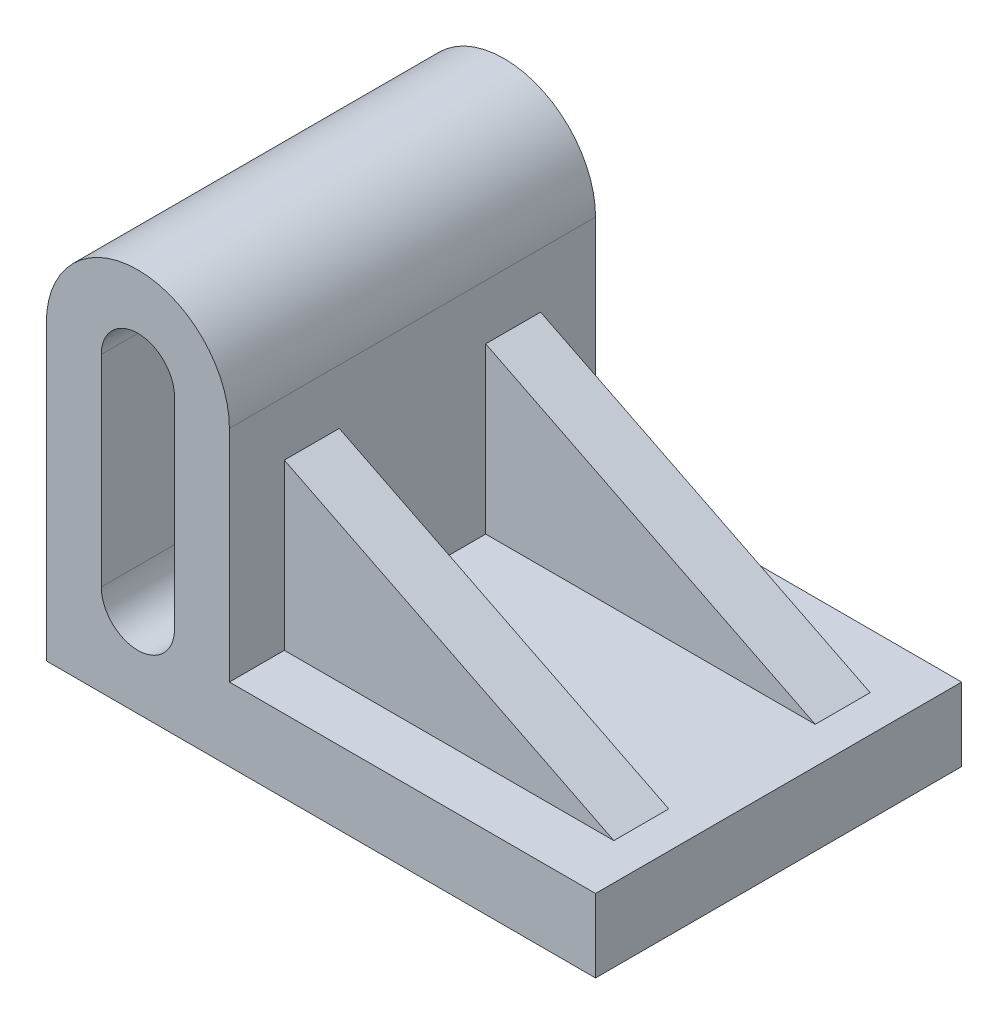
from build123d import *

# Parameters (mm, degrees)
BOSS_EXTRUDE1_DEPTH = 50
BOSS_EXTRUDE2_START = 20
BOSS_EXTRUDE2_DEPTH = 15


with BuildPart() as part:
    # Sketch1 → Boss-Extrude1 (new, symmetric)
    with BuildSketch(Plane.XY):
        with BuildLine():
            Line((0, 80), (0, 0))
            Line((0, 0), (150, 0))
            Line((150, 0), (150, 20))
            Line((150, 20), (140, 20))
            Line((140, 20), (50, 20))
            Line((50, 20), (50, 65))
            Line((50, 65), (50, 80))
            ThreePointArc((50, 80), (25, 105), (0, 80))
        make_face()
        with BuildLine():
            ThreePointArc((15, 80), (25, 90), (35, 80))
            Line((35, 80), (35, 25))
            ThreePointArc((35, 25), (25, 15), (15, 25))
            Line((15, 25), (15, 80))
        make_face(mode=Mode.SUBTRACT)
    extrude(amount=BOSS_EXTRUDE1_DEPTH, both=True)

    # Sketch1<3> → Boss-Extrude2 (add)
    with BuildSketch(Plane.XY.offset(BOSS_EXTRUDE2_START)):
        Polygon((140, 20), (50, 65), (50, 20), align=None)
    boss_extrude2 = extrude(amount=BOSS_EXTRUDE2_DEPTH)

    # Mirror1: Boss-Extrude2 across plane
    add(boss_extrude2.mirror(Plane.XY))


solid = part.part
